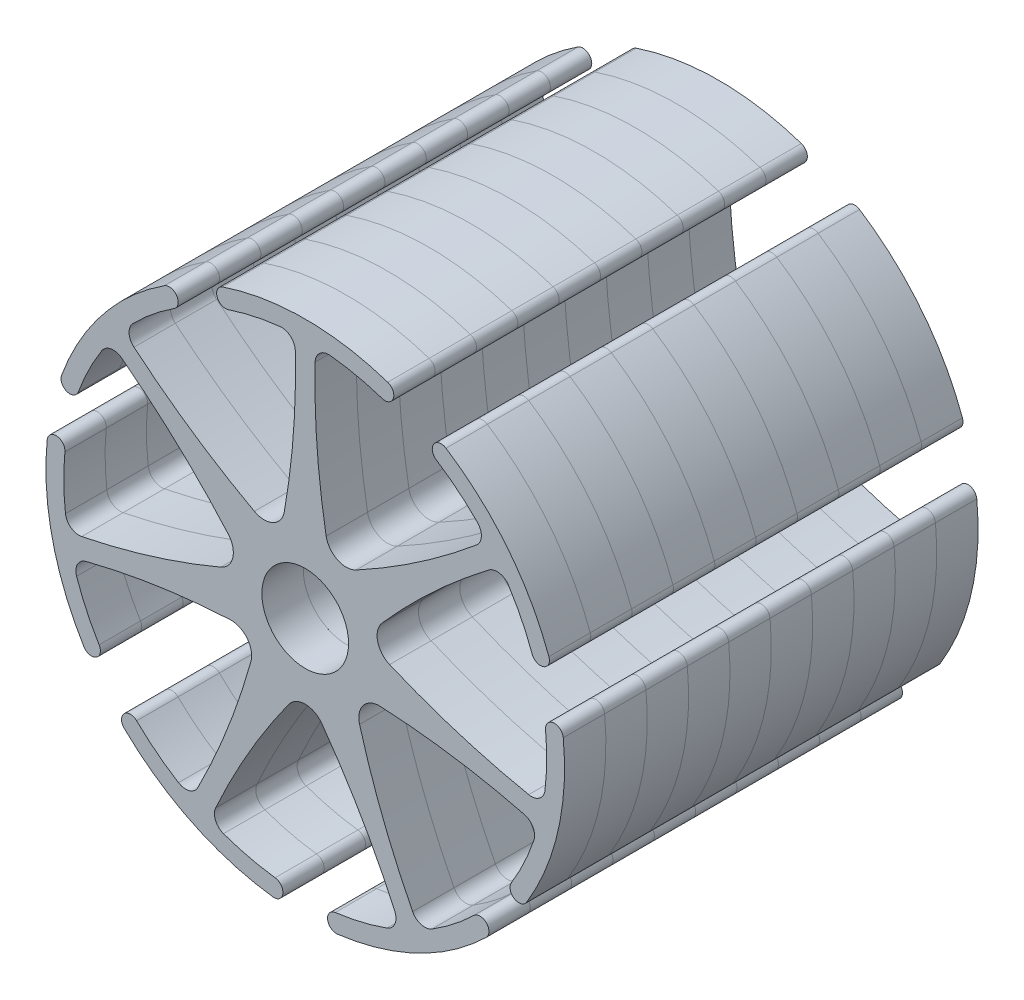
from build123d import *

# Parameters (mm, degrees)
BOSS_EXTRUDE3_DEPTH = 3.03
FILLET1_R           = 1
CIRPATTERN1_COUNT   = 7
SKETCH6_R           = 3.175
CUT_EXTRUDE1_DEPTH  = 82
FILLET2_R           = 1.5
LPATTERN1_COUNT     = 10
LPATTERN1_PITCH     = 3.03


with BuildPart() as part:
    # Sketch2 → Boss-Extrude3 (new body)
    with BuildSketch(Plane.XY):
        with BuildLine():
            ThreePointArc((-0.762637922, 17.679072372), (-1.118529432, 8.747148204), (-2.9606278, 0))
            Line((-2.9606278, 0), (2.9606278, 0))
            ThreePointArc((2.9606278, 0), (1.118529432, 8.747148204), (0.762637922, 17.679072372))
            ThreePointArc((0.762637922, 17.679072372), (3.228694468, 17.398469719), (5.631233503, 16.775590176))
            ThreePointArc((5.631233503, 16.775590176), (6.457131729, 17.186362561), (6.046359344, 18.012260788))
            ThreePointArc((6.046359344, 18.012260788), (0, 19), (-6.046359344, 18.012260788))
            ThreePointArc((-6.046359344, 18.012260788), (-6.457131729, 17.186362561), (-5.631233503, 16.775590176))
            ThreePointArc((-5.631233503, 16.775590176), (-3.228694468, 17.398469719), (-0.762637922, 17.679072372))
        make_face()
    extrude(amount=-BOSS_EXTRUDE3_DEPTH)

    # Fillet1
    fillet1_edges = [part.edges().sort_by_distance(p)[0] for p in [
        (0.762637922, 17.679072372, -1.515),
        (-0.762637922, 17.679072372, -1.515),
    ]]
    fillet(fillet1_edges, radius=FILLET1_R)

    # CirPattern1: part ×7 about axis
    cirpattern1_axis = Axis((0, 0, 0), (0, 0, 1))


with BuildPart() as part_1:
    add(part.part)
    for i in range(1, CIRPATTERN1_COUNT):
        add(part.part.rotate(cirpattern1_axis, i * 360 / CIRPATTERN1_COUNT))

    # Sketch6 → Cut-Extrude1 (cut)
    with BuildSketch(Plane(origin=(0, 0, -3.03), x_dir=(-1, 0, 0), z_dir=(0, 0, -1))):
        Circle(SKETCH6_R)
    extrude(amount=-CUT_EXTRUDE1_DEPTH, mode=Mode.SUBTRACT)

    # Fillet2
    fillet2_edges = [part_1.edges().sort_by_distance(p)[0] for p in [
        (-1.927281752, 4.002041795, -1.515),
        (1.927281752, 4.002041795, -1.515),
        (4.330562787, 0.988422697, -1.515),
        (3.472841716, -2.769498852, -1.515),
        (0, -4.441931278, -1.515),
        (-3.472841716, -2.769498852, -1.515),
        (-4.330562787, 0.988422697, -1.515),
    ]]
    fillet(fillet2_edges, radius=FILLET2_R)


with BuildPart() as lpattern1_1:
    # LPattern1: pattern copy
    add(part_1.part.moved(Location(Vector(0, 0, 1) * (1 * LPATTERN1_PITCH))))


with BuildPart() as lpattern1_2:
    # LPattern1: pattern copy
    add(part_1.part.moved(Location(Vector(0, 0, 1) * (2 * LPATTERN1_PITCH))))


with BuildPart() as lpattern1_3:
    # LPattern1: pattern copy
    add(part_1.part.moved(Location(Vector(0, 0, 1) * (3 * LPATTERN1_PITCH))))


with BuildPart() as lpattern1_4:
    # LPattern1: pattern copy
    add(part_1.part.moved(Location(Vector(0, 0, 1) * (4 * LPATTERN1_PITCH))))


with BuildPart() as lpattern1_5:
    # LPattern1: pattern copy
    add(part_1.part.moved(Location(Vector(0, 0, 1) * (5 * LPATTERN1_PITCH))))


with BuildPart() as lpattern1_6:
    # LPattern1: pattern copy
    add(part_1.part.moved(Location(Vector(0, 0, 1) * (6 * LPATTERN1_PITCH))))


with BuildPart() as lpattern1_7:
    # LPattern1: pattern copy
    add(part_1.part.moved(Location(Vector(0, 0, 1) * (7 * LPATTERN1_PITCH))))


with BuildPart() as lpattern1_8:
    # LPattern1: pattern copy
    add(part_1.part.moved(Location(Vector(0, 0, 1) * (8 * LPATTERN1_PITCH))))


with BuildPart() as lpattern1_9:
    # LPattern1: pattern copy
    add(part_1.part.moved(Location(Vector(0, 0, 1) * (9 * LPATTERN1_PITCH))))


solid = Compound([part_1.part, lpattern1_1.part, lpattern1_2.part, lpattern1_3.part, lpattern1_4.part, lpattern1_5.part, lpattern1_6.part, lpattern1_7.part, lpattern1_8.part, lpattern1_9.part])
